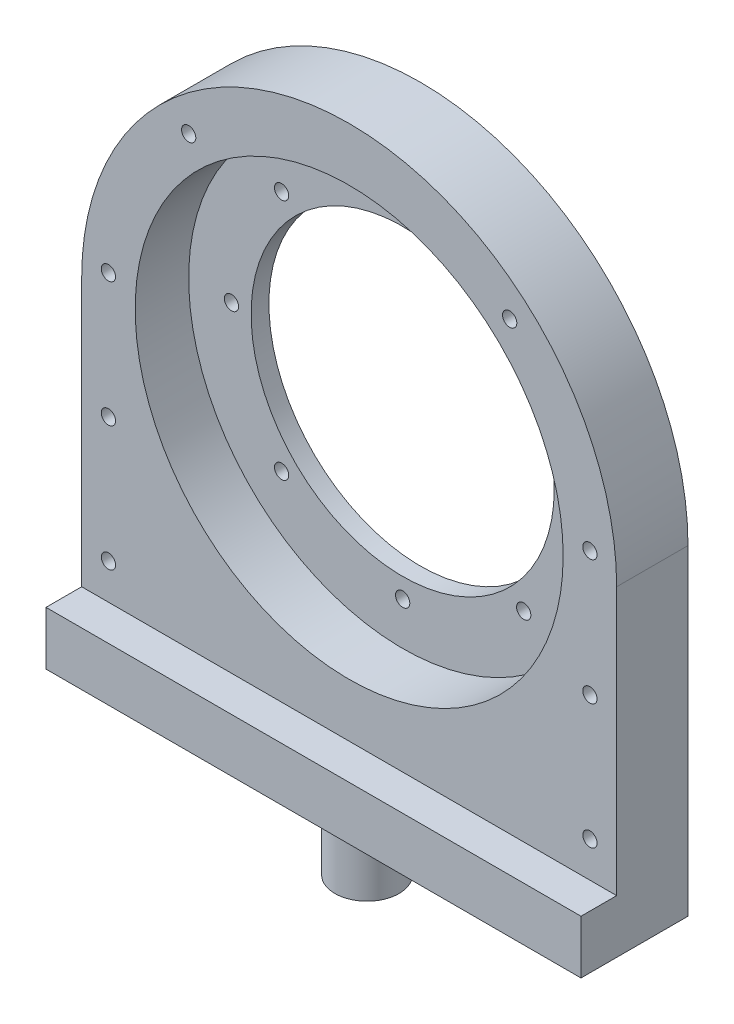
from build123d import *

# Parameters (mm, degrees)
SKETCH1_W           = 30
SKETCH1_H           = 15
BOSS_EXTRUDE1_DEPTH = 150
SKETCH2_R           = 12.7
CUT_EXTRUDE1_DEPTH  = 5
SKETCH3_R           = 9
BOSS_EXTRUDE2_DEPTH = 25
SKETCH4_W           = 150
SKETCH4_H           = 20
BOSS_EXTRUDE3_DEPTH = 150
SKETCH5_R           = 42.5
CUT_EXTRUDE2_DEPTH  = 150
SKETCH6_R           = 60
CUT_EXTRUDE3_DEPTH  = 15
SKETCH7_R           = 2
CUT_EXTRUDE4_DEPTH  = 15
SKETCH17_R          = 2
CUT_EXTRUDE5_DEPTH  = 20
SKETCH18_R          = 2
CUT_EXTRUDE6_DEPTH  = 20


with BuildPart() as part:
    # Sketch1 → Boss-Extrude1 (new body)
    with BuildSketch(Plane(origin=(0, 0, 0), x_dir=(0, 0, -1), z_dir=(1, 0, 0))):
        with Locations((-6.718464351, -7.5)):
            Rectangle(SKETCH1_W, SKETCH1_H)
    extrude(amount=BOSS_EXTRUDE1_DEPTH)

    # Sketch2 → Cut-Extrude1 (cut)
    with BuildSketch(Plane.XZ.offset(15)):
        with Locations(Location((75, 6.718464351, 0), (0, 0, 270))):
            Circle(SKETCH2_R)
    extrude(amount=-CUT_EXTRUDE1_DEPTH, mode=Mode.SUBTRACT)

    # Sketch3 → Boss-Extrude2 (add)
    with BuildSketch(Plane.XZ.offset(10)):
        with Locations(Location((75, 6.718464351, 0), (0, 0, 270))):
            Circle(SKETCH3_R)
    extrude(amount=BOSS_EXTRUDE2_DEPTH)

    # Sketch4 → Boss-Extrude3 (add)
    with BuildSketch(Plane(origin=(0, 0, 0), x_dir=(1, 0, 0), z_dir=(0, 1, 0))):
        with Locations((75, -1.718464351)):
            Rectangle(SKETCH4_W, SKETCH4_H)
    extrude(amount=BOSS_EXTRUDE3_DEPTH)

    # Sketch5 → Cut-Extrude2 (cut)
    with BuildSketch(Plane.XY.offset(11.718464351)):
        with BuildLine():
            Line((75, 150), (0, 150))
            Line((0, 150), (0, 75))
            ThreePointArc((0, 75), (21.966991411, 128.033008589), (75, 150))
        make_face()
        with BuildLine():
            Line((150, 150), (75, 150))
            ThreePointArc((75, 150), (128.033008589, 128.033008589), (150, 75))
            Line((150, 75), (150, 150))
        make_face()
        with Locations((75, 75)):
            Circle(SKETCH5_R)
    extrude(amount=-CUT_EXTRUDE2_DEPTH, mode=Mode.SUBTRACT)

    # Sketch6 → Cut-Extrude3 (cut)
    with BuildSketch(Plane.XY.offset(11.718464351)):
        with Locations((75, 75)):
            Circle(SKETCH6_R)
    extrude(amount=-CUT_EXTRUDE3_DEPTH, mode=Mode.SUBTRACT)

    # Sketch7 → Cut-Extrude4 (cut)
    with BuildSketch(Plane.XY.offset(-3.281535649)):
        with Locations((75, 123)):
            Circle(SKETCH7_R)
        with Locations((108.941125497, 108.941125497)):
            Circle(SKETCH7_R)
        with Locations((123, 75)):
            Circle(SKETCH7_R)
        with Locations((108.941125497, 41.058874503)):
            Circle(SKETCH7_R)
        with Locations((75, 27)):
            Circle(SKETCH7_R)
        with Locations((41.058874503, 41.058874503)):
            Circle(SKETCH7_R)
        with Locations((27, 75)):
            Circle(SKETCH7_R)
        with Locations((41.058874503, 108.941125497)):
            Circle(SKETCH7_R)
    extrude(amount=-CUT_EXTRUDE4_DEPTH, mode=Mode.SUBTRACT)

    # Sketch17 → Cut-Extrude5 (cut)
    with BuildSketch(Plane.XY.offset(11.718464351)):
        with Locations((7.5, 10)):
            Circle(SKETCH17_R)
        with Locations((142.5, 10)):
            Circle(SKETCH17_R)
        with Locations((142.5, 45)):
            Circle(SKETCH17_R)
        with Locations((142.5, 80)):
            Circle(SKETCH17_R)
        with Locations((7.5, 45)):
            Circle(SKETCH17_R)
        with Locations((7.5, 80)):
            Circle(SKETCH17_R)
    extrude(amount=-CUT_EXTRUDE5_DEPTH, mode=Mode.SUBTRACT)

    # Sketch18 → Cut-Extrude6 (cut)
    with BuildSketch(Plane.XY.offset(11.718464351)):
        with Locations((30, 125)):
            Circle(SKETCH18_R)
        with Locations((120, 125)):
            Circle(SKETCH18_R)
    extrude(amount=-CUT_EXTRUDE6_DEPTH, mode=Mode.SUBTRACT)


solid = part.part
